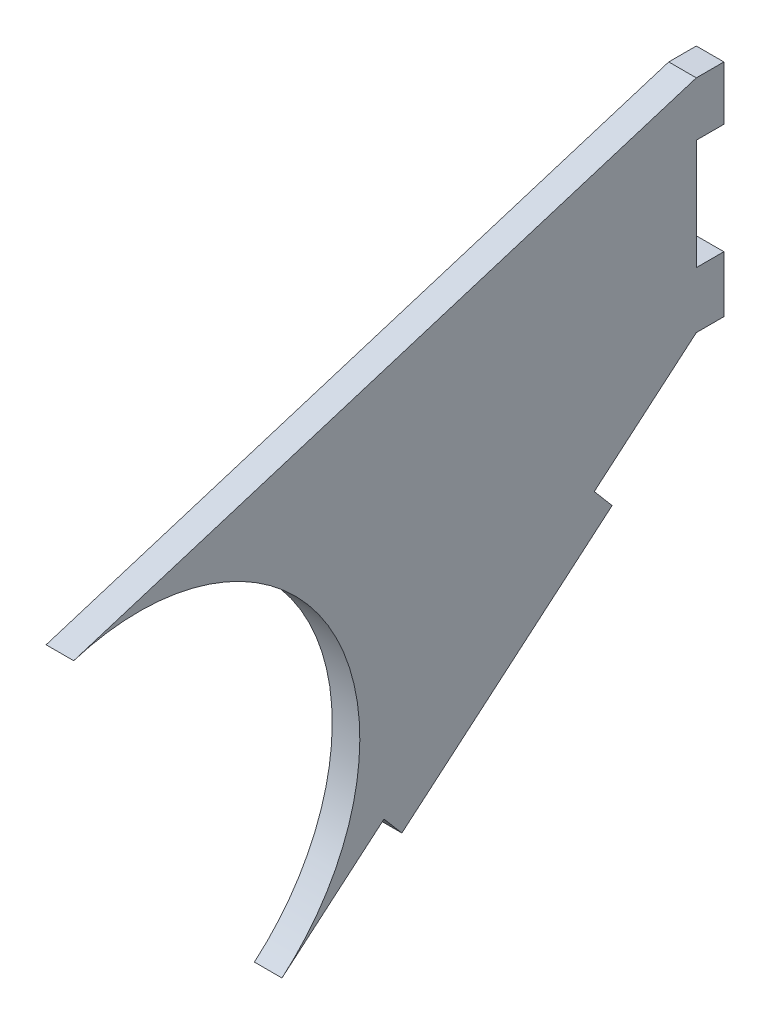
from build123d import *

# Parameters (mm, degrees)
SKETCH1_W           = 1.5875
SKETCH1_H           = 3.109195134
SKETCH1_H_2         = 3.240804866
BOSS_EXTRUDE1_DEPTH = 1.5875


with BuildPart() as part:
    # Sketch1 → Boss-Extrude1 (new body)
    with BuildSketch(Plane(origin=(0, 0, 0), x_dir=(0, 0, -1), z_dir=(1, 0, 0))):
        with BuildLine():
            ThreePointArc((-23.848326893, -26.661593728), (-20.937975975, -10.862409095), (-35.836269612, -4.8519828))
            Line((-35.836269612, -4.8519828), (0, 6.284195134))
            Line((0, 6.284195134), (0, -6.415804866))
            Line((0, -6.415804866), (-23.848326893, -26.661593728))
        make_face()
        with Locations((0.79375, 4.729597567)):
            Rectangle(SKETCH1_W, SKETCH1_H)
        with Locations((0.79375, -4.795402433)):
            Rectangle(SKETCH1_W, SKETCH1_H_2)
        Polygon((-4.845708228, -12.611927822), (-5.873104867, -11.401716106), (-17.975222027, -21.675682489), (-16.947825388, -22.885894205), align=None)
    extrude(amount=BOSS_EXTRUDE1_DEPTH)


solid = part.part
